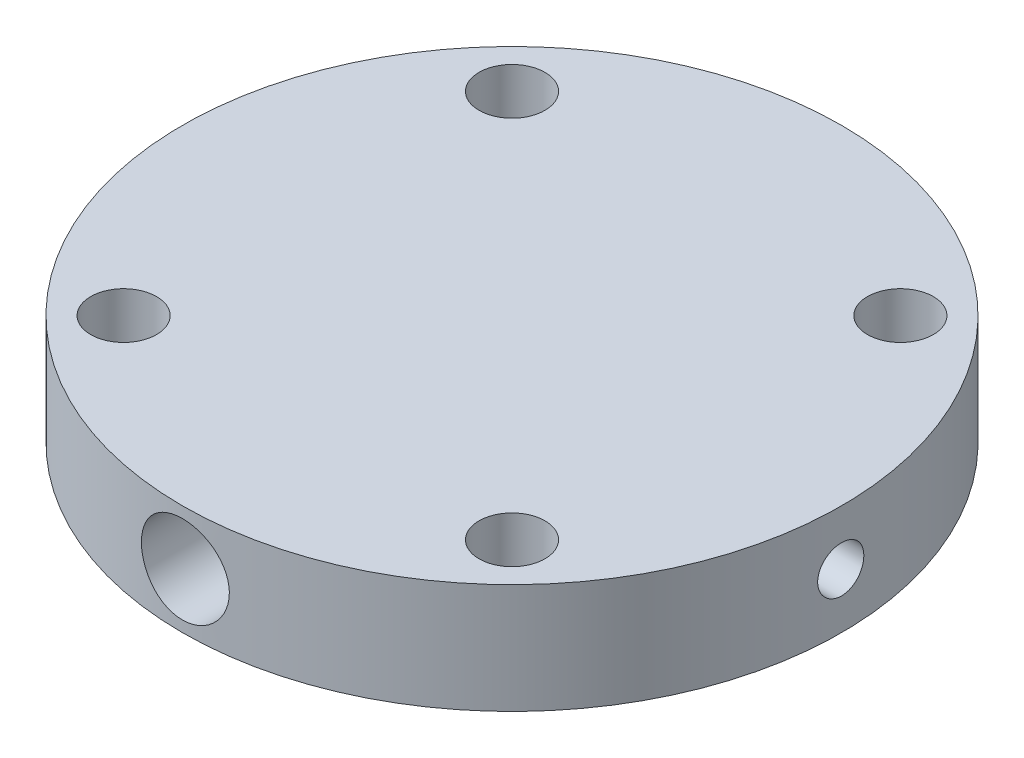
from build123d import *

# Parameters (mm, degrees)
SKETCH_1_R               = 30
SKETCH_1_R_2             = 3
EXTRUDE_1_DEPTH          = 10
CUT_EXTRUDE_1_DEPTH      = 44.588989435
CUT_EXTRUDE_1_DEPTH_BACK = 44.588989435
SKETCH_2_R               = 4
SKETCH_3_R               = 2
EXTRUDE_2_DEPTH          = 32.5
HOLE_WIZARD_M5_2_D       = 4.2


with BuildPart() as part:
    # 草图1 → 凸台-拉伸1 (new body)
    with BuildSketch(Plane(origin=(0, 0, 0), x_dir=(1, 0, 0), z_dir=(0, 1, 0))):
        with Locations(Location((0, 0, 0), (0, 0, 270))):
            Circle(SKETCH_1_R)
        with Locations(Location((-17.67766953, 17.67766953, 0), (0, 0, 270))):
            Circle(SKETCH_1_R_2, mode=Mode.SUBTRACT)
        with Locations(Location((17.67766953, 17.67766953, 0), (0, 0, 90))):
            Circle(SKETCH_1_R_2, mode=Mode.SUBTRACT)
        with Locations(Location((17.67766953, -17.67766953, 0), (0, 0, 270))):
            Circle(SKETCH_1_R_2, mode=Mode.SUBTRACT)
        with Locations(Location((-17.67766953, -17.67766953, 0), (0, 0, 90))):
            Circle(SKETCH_1_R_2, mode=Mode.SUBTRACT)
    extrude(amount=EXTRUDE_1_DEPTH)

    # 草图2 → 切除-拉伸1 (cut, two sides: drawn at the far end of the back side and taken through both)
    with BuildSketch(Plane.XY.offset(-CUT_EXTRUDE_1_DEPTH_BACK)):
        with Locations((0, 5)):
            Circle(SKETCH_2_R)
    extrude(amount=CUT_EXTRUDE_1_DEPTH + CUT_EXTRUDE_1_DEPTH_BACK, mode=Mode.SUBTRACT)

    # 草图3 → 凸台-拉伸2 (add, symmetric)
    with BuildSketch(Plane(origin=(0, 0, 0), x_dir=(0, 0, -1), z_dir=(1, 0, 0))):
        with Locations(Location((0, 5, 0), (0, 0, 180))):
            Circle(SKETCH_3_R)
    extrude(amount=EXTRUDE_2_DEPTH, both=True)

    # M5 螺纹孔2 (through all)
    with Locations(Plane(origin=(32.5, 0, 0), x_dir=(0, 0, -1), z_dir=(1, 0, 0))):
        with Locations((0, 5)):
            Hole(HOLE_WIZARD_M5_2_D / 2)


solid = part.part
